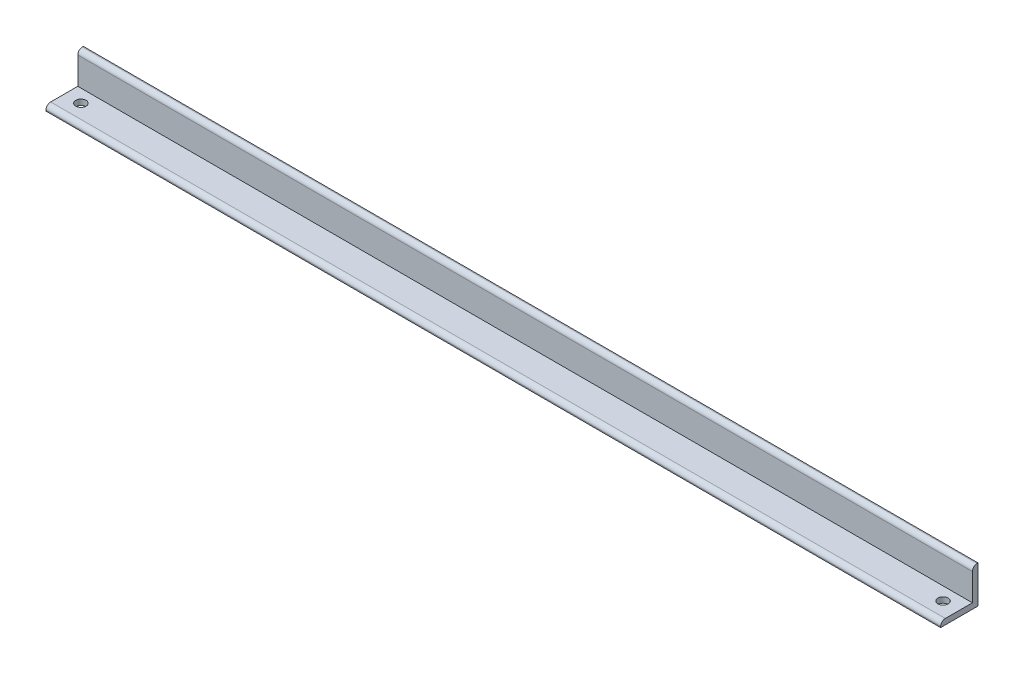
from build123d import *

# Parameters (mm, degrees)
SKETCH_1_W             = 1915
SKETCH_1_H             = 80
EXTRUDE_1_DEPTH        = 80
SKETCH_3_W             = 68
SKETCH_3_H             = 68
CUT_EXTRUDE_2_DEPTH    = 1919.339125389
FILLET_1_R             = 10
SKETCH_7_R             = 11
CUT_EXTRUDE_5_DEPTH    = 1919.339125389
PATTERN_LINEAR_3_COUNT = 2
PATTERN_LINEAR_3_PITCH = 1845.383428992


with BuildPart() as part:
    # 草图1 → 拉伸1 (new body)
    with BuildSketch(Plane.XY):
        with Locations((957.5, 40)):
            Rectangle(SKETCH_1_W, SKETCH_1_H)
    extrude(amount=EXTRUDE_1_DEPTH)

    # 草图3 → 拉伸2 (cut, through all)
    with BuildSketch(Plane.ZY):
        with Locations((46, 46)):
            Rectangle(SKETCH_3_W, SKETCH_3_H)
    extrude(amount=-CUT_EXTRUDE_2_DEPTH, mode=Mode.SUBTRACT)

    # 圆角1
    fillet_1_edges = [part.edges().sort_by_distance(p)[0] for p in [
        (957.5, 80, 12),
        (957.5, 12, 80),
    ]]
    fillet(fillet_1_edges, radius=FILLET_1_R)

    # 草图7 → 拉伸5 (cut, through all)
    with BuildSketch(Plane.XZ):
        with Locations(Location((34.75, 40, 0), (0, 0, 270))):
            Circle(SKETCH_7_R)
    cut_extrude_5 = extrude(amount=-CUT_EXTRUDE_5_DEPTH, mode=Mode.SUBTRACT)

    # 阵列(线性)3: 拉伸5 ×2
    with Locations(*[(i * PATTERN_LINEAR_3_PITCH, 0, 0) for i in range(1, PATTERN_LINEAR_3_COUNT)]):
        add(cut_extrude_5, mode=Mode.SUBTRACT)


solid = part.part
